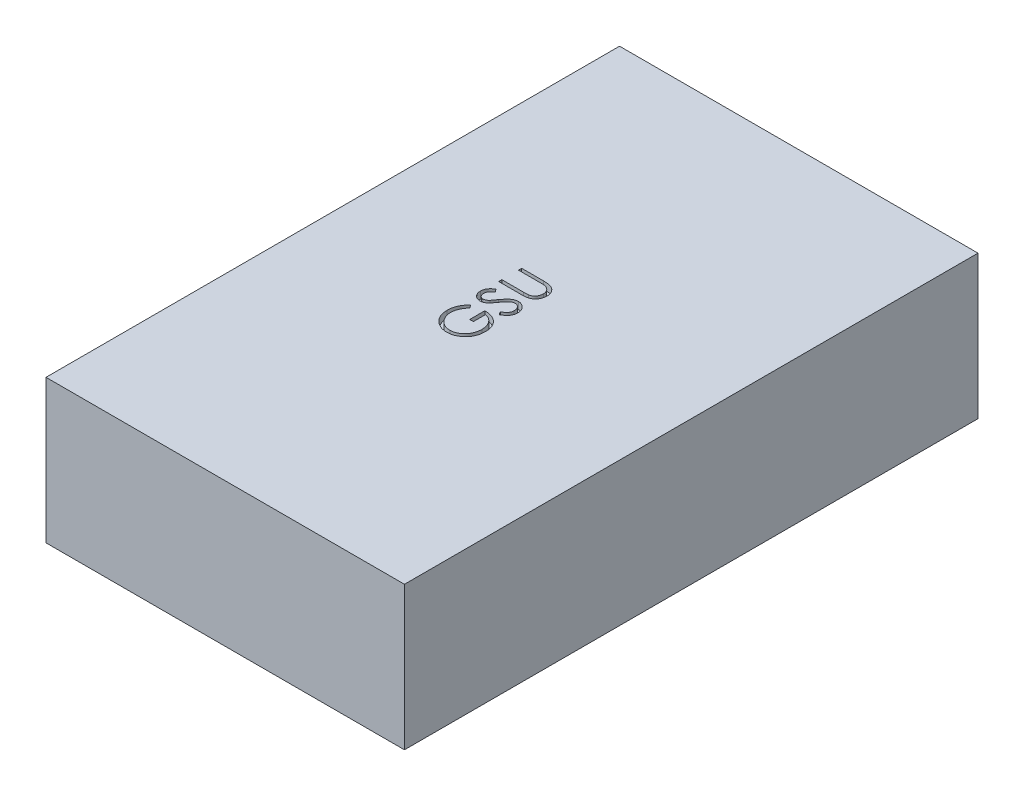
from build123d import *

# Parameters (mm, degrees)
SKETCH1_W           = 100
SKETCH1_H           = 160
BOSS_EXTRUDE1_DEPTH = 40
CUT_EXTRUDE1_DEPTH  = 2


with BuildPart() as part:
    # Sketch1 → Boss-Extrude1 (new body)
    with BuildSketch(Plane(origin=(0, 0, 0), x_dir=(1, 0, 0), z_dir=(0, 1, 0))):
        Rectangle(SKETCH1_W, SKETCH1_H)
    extrude(amount=BOSS_EXTRUDE1_DEPTH)

    # Sketch2 → Cut-Extrude1 (cut)
    with BuildSketch(Plane(origin=(0, 40, 0), x_dir=(1, 0, 0), z_dir=(0, 1, 0))):
        with BuildLine():
            Line((-8.293269231, -3.333333333), (-7.564102564, -4.102564103))
            add(Edge.make_bspline(
                [(-7.564102564, -4.102564103), (-7.69509177, -4.241732904), (-7.95394667, -4.516751946), (-8.289268783, -4.965894639), (-8.579362865, -5.432625649), (-8.813635978, -5.917699647), (-8.997412154, -6.408396791), (-9.131000621, -6.896279515), (-9.215601077, -7.378188939), (-9.225762275, -7.698658374), (-9.230769231, -7.856570513)],
                knots=[0, 0, 0, 0, 1.089067066, 2.152164705, 3.18986567, 4.218445106, 5.218487318, 6.173592265, 7.100032889, 8, 8, 8, 8], degree=3))
            add(Edge.make_bspline(
                [(-9.230769231, -7.856570513), (-9.2295875, -7.953469656), (-9.227227102, -8.147016629), (-9.197100773, -8.434507897), (-9.15377259, -8.718984003), (-9.09108151, -8.99990793), (-9.011627057, -9.277825895), (-8.91224001, -9.551771289), (-8.796367918, -9.822255206), (-8.662475005, -10.086729546), (-8.515390215, -10.343131641), (-8.352392612, -10.585291632), (-8.178716827, -10.814767236), (-7.989976038, -11.027193541), (-7.788020888, -11.223983583), (-7.576488411, -11.408757012), (-7.351219635, -11.578070093), (-7.113140916, -11.728886207), (-6.86779105, -11.865079332), (-6.617250843, -11.982771332), (-6.363846124, -12.085085488), (-6.105668795, -12.163011089), (-5.845380562, -12.229013588), (-5.581617387, -12.274959977), (-5.313690482, -12.300949452), (-5.134268489, -12.30543657), (-5.044070513, -12.307692308)],
                knots=[0, 0, 0, 0, 1.028150113, 2.053633673, 3.06513288, 4.081487945, 5.106702018, 6.131327874, 7.172780699, 8.228344599, 9.276313556, 10.308389736, 11.324843658, 12.329040066, 13.321460474, 14.316307835, 15.308626991, 16.309440696, 17.305625405, 18.28535951, 19.246194545, 20.203493668, 21.145557131, 22.095268976, 23.042464743, 24, 24, 24, 24], degree=3))
            add(Edge.make_bspline(
                [(-5.044070513, -12.307692308), (-4.951868624, -12.30553175), (-4.767716618, -12.301216534), (-4.492869755, -12.273635971), (-4.222136662, -12.222335371), (-3.955091511, -12.1543018), (-3.691202837, -12.067808441), (-3.430746028, -11.961544117), (-3.173746404, -11.834955166), (-2.922755212, -11.688751541), (-2.67846912, -11.527295918), (-2.446433466, -11.349721107), (-2.229348557, -11.155728146), (-2.024043578, -10.948874022), (-1.831814212, -10.727274033), (-1.654977492, -10.488778229), (-1.490798979, -10.236725107), (-1.341082306, -9.971002852), (-1.207346971, -9.694420053), (-1.088420656, -9.410830249), (-0.990479932, -9.119321959), (-0.910656714, -8.821428626), (-0.84522731, -8.517504975), (-0.803134505, -8.206008401), (-0.772589275, -7.889229232), (-0.770355932, -7.675690284), (-0.769230769, -7.568108974)],
                knots=[0, 0, 0, 0, 0.935915162, 1.869274651, 2.799799983, 3.730201895, 4.664668062, 5.616159355, 6.583070886, 7.570012957, 8.562524459, 9.553461134, 10.53281078, 11.515274572, 12.509912756, 13.507571325, 14.526460018, 15.561318395, 16.601025881, 17.643204557, 18.680545676, 19.719612342, 20.772381578, 21.833430283, 22.908478249, 24, 24, 24, 24], degree=3))
            add(Edge.make_bspline(
                [(-0.769230769, -7.568108974), (-0.771939863, -7.438456026), (-0.77725961, -7.183861397), (-0.818704957, -6.80962191), (-0.883352014, -6.450157287), (-0.978320732, -6.106637752), (-1.098527728, -5.777816622), (-1.247180813, -5.464906656), (-1.422715912, -5.167043817), (-1.621578466, -4.885517358), (-1.843145513, -4.627020155), (-2.080101819, -4.391757074), (-2.335517338, -4.187818154), (-2.60558548, -4.009111532), (-2.892889502, -3.861405123), (-3.195831109, -3.740131185), (-3.514597751, -3.647181309), (-3.734859238, -3.609023912), (-3.846153846, -3.58974359)],
                knots=[0, 0, 0, 0, 1.130199668, 2.219330667, 3.279027493, 4.311506524, 5.322739849, 6.327972234, 7.327472899, 8.33386792, 9.329086447, 10.29244429, 11.240784345, 12.174119183, 13.111530729, 14.052100829, 15.015757696, 16, 16, 16, 16], degree=3))
            Line((-3.846153846, -3.58974359), (-3.846153846, -6.923076923))
            Line((-3.846153846, -6.923076923), (-4.871794872, -6.923076923))
            Line((-4.871794872, -6.923076923), (-4.871794872, -2.692307692))
            add(Edge.make_bspline(
                [(-4.871794872, -2.692307692), (-4.680630618, -2.697181545), (-4.306487642, -2.706720555), (-3.760858296, -2.773631742), (-3.245510601, -2.88167892), (-2.759901825, -3.029279811), (-2.304720131, -3.220352041), (-1.879503371, -3.452844979), (-1.486998568, -3.730479611), (-1.124001415, -4.043366586), (-0.800203666, -4.394509323), (-0.515615272, -4.774419666), (-0.275893514, -5.18372529), (-0.08086305, -5.622039025), (0.071348364, -6.087925978), (0.179267155, -6.582464206), (0.243924193, -7.104983065), (0.252185277, -7.463087856), (0.256410256, -7.646233974)],
                knots=[0, 0, 0, 0, 1.140356446, 2.231883559, 3.274166699, 4.278491846, 5.25512956, 6.21435461, 7.1637429, 8.11826594, 9.068280886, 10.0076534, 10.945064095, 11.891975133, 12.864533718, 13.863980011, 14.907571808, 16, 16, 16, 16], degree=3))
            add(Edge.make_bspline(
                [(0.256410256, -7.646233974), (0.254784196, -7.759120075), (0.25157708, -7.981767849), (0.228784659, -8.310599072), (0.193697298, -8.630363703), (0.140711231, -8.941015157), (0.075812219, -9.243696134), (-0.007292692, -9.536894948), (-0.103488976, -9.821728497), (-0.212905186, -10.098637027), (-0.339681347, -10.365107161), (-0.480566032, -10.622325781), (-0.634832777, -10.871714712), (-0.805149479, -11.111575183), (-0.990242222, -11.343156959), (-1.190481991, -11.564966797), (-1.405256618, -11.778246449), (-1.557768074, -11.911847774), (-1.634615385, -11.979166667)],
                knots=[0, 0, 0, 0, 1.107784379, 2.184907829, 3.233506516, 4.263428166, 5.276301166, 6.270063455, 7.25232949, 8.225834625, 9.190232166, 10.146266622, 11.1027726, 12.066435141, 13.031522626, 14.010570082, 14.99756817, 16, 16, 16, 16], degree=3))
            add(Edge.make_bspline(
                [(-1.634615385, -11.979166667), (-1.756531536, -12.076840758), (-1.998340157, -12.270567651), (-2.385768569, -12.519933813), (-2.786916741, -12.73250925), (-3.202901394, -12.904988741), (-3.63333343, -13.039668988), (-4.077662834, -13.136258282), (-4.536461778, -13.192850536), (-4.846933963, -13.201003501), (-5.00400641, -13.205128205)],
                knots=[0, 0, 0, 0, 1.023165419, 2.029347347, 3.013907458, 3.994755782, 4.975994455, 5.96558838, 6.970761222, 8, 8, 8, 8], degree=3))
            add(Edge.make_bspline(
                [(-5.00400641, -13.205128205), (-5.121624275, -13.203607525), (-5.355365154, -13.200585492), (-5.702386029, -13.163941155), (-6.043245165, -13.111365692), (-6.377663839, -13.034088333), (-6.705865747, -12.936670659), (-7.028001971, -12.815088427), (-7.344267552, -12.673534777), (-7.652466942, -12.508992727), (-7.948580126, -12.325939192), (-8.231158039, -12.127060176), (-8.495620949, -11.910821076), (-8.742581488, -11.676592234), (-8.975699929, -11.42909529), (-9.190106786, -11.16313443), (-9.389157173, -10.882739185), (-9.569026346, -10.585735927), (-9.730648786, -10.276811267), (-9.872329012, -9.956636736), (-9.989425073, -9.625328685), (-10.088778492, -9.285364236), (-10.162250386, -8.934171439), (-10.215532498, -8.574298459), (-10.251991359, -8.203869572), (-10.254923518, -7.953480916), (-10.256410256, -7.826522436)],
                knots=[0, 0, 0, 0, 1.00895651, 2.005089799, 2.991467152, 3.967318338, 4.948153826, 5.927364234, 6.919980553, 7.91976625, 8.923240147, 9.905815003, 10.88314567, 11.851989312, 12.825009789, 13.798721852, 14.781296708, 15.773896486, 16.776076962, 17.771600213, 18.775744723, 19.78957137, 20.808953803, 21.851964491, 22.910847925, 24, 24, 24, 24], degree=3))
            add(Edge.make_bspline(
                [(-10.256410256, -7.826522436), (-10.254754566, -7.722984597), (-10.251471526, -7.517681229), (-10.228715388, -7.212179137), (-10.192647157, -6.911399095), (-10.143427766, -6.614895124), (-10.076388651, -6.323676935), (-9.99616498, -6.036914919), (-9.902759773, -5.754193387), (-9.791363069, -5.476398389), (-9.664924141, -5.201662058), (-9.522600077, -4.928456799), (-9.361957206, -4.657716097), (-9.182518533, -4.388970435), (-8.987365911, -4.120525127), (-8.770917843, -3.856626149), (-8.541709969, -3.590903451), (-8.37690373, -3.420041125), (-8.293269231, -3.333333333)],
                knots=[0, 0, 0, 0, 0.985871117, 1.954866573, 2.915460327, 3.869826059, 4.81536089, 5.759505086, 6.70452669, 7.649098992, 8.607881297, 9.583363685, 10.581137262, 11.603961102, 12.659522466, 13.73993555, 14.853081303, 16, 16, 16, 16], degree=3))
        make_face()
        with BuildLine():
            Line((-1.929086538, -1.666666667), (-2.435897436, -0.821314103))
            add(Edge.make_bspline(
                [(-2.435897436, -0.821314103), (-2.304284907, -0.742690568), (-2.052120382, -0.592050909), (-1.711383124, -0.340761311), (-1.421776961, -0.080381565), (-1.184986654, 0.191016531), (-0.998561264, 0.471776383), (-0.866554887, 0.763730822), (-0.784223529, 1.065895995), (-0.774223282, 1.271535485), (-0.769230769, 1.374198718)],
                knots=[0, 0, 0, 0, 1.272034388, 2.437168799, 3.508375237, 4.49857839, 5.41946034, 6.295179144, 7.148887113, 8, 8, 8, 8], degree=3))
            add(Edge.make_bspline(
                [(-0.769230769, 1.374198718), (-0.771730785, 1.461857712), (-0.776687073, 1.635641874), (-0.822386505, 1.891981586), (-0.897150681, 2.139693044), (-0.998501617, 2.376313841), (-1.123083951, 2.595575075), (-1.269989904, 2.790929086), (-1.439734474, 2.955884837), (-1.626029427, 3.09263515), (-1.825800095, 3.198451547), (-2.031635392, 3.278428609), (-2.246359533, 3.323220072), (-2.390966647, 3.32994142), (-2.463942308, 3.333333333)],
                knots=[0, 0, 0, 0, 1.09553864, 2.171907928, 3.244545276, 4.325730702, 5.384330216, 6.391480148, 7.371786628, 8.333890167, 9.27165687, 10.191402356, 11.087295184, 12, 12, 12, 12], degree=3))
            add(Edge.make_bspline(
                [(-2.463942308, 3.333333333), (-2.547229668, 3.329211489), (-2.715895654, 3.320864303), (-2.965168274, 3.247300006), (-3.212917594, 3.134970402), (-3.366195373, 3.029393198), (-3.445512821, 2.974759615)],
                knots=[0, 0, 0, 0, 0.938992559, 1.901562324, 2.914110574, 4, 4, 4, 4], degree=3))
            add(Edge.make_bspline(
                [(-3.445512821, 2.974759615), (-3.502796701, 2.929992996), (-3.623057042, 2.836011077), (-3.801916277, 2.674302935), (-3.986783264, 2.485515488), (-4.181716481, 2.272232592), (-4.38509684, 2.034096483), (-4.598511417, 1.771015025), (-4.817599065, 1.480742967), (-4.964345407, 1.27700199), (-5.040064103, 1.171875)],
                knots=[0, 0, 0, 0, 0.72225051, 1.516274602, 2.393638633, 3.3469932, 4.386926276, 5.505032946, 6.712638081, 8, 8, 8, 8], degree=3))
            add(Edge.make_bspline(
                [(-5.040064103, 1.171875), (-5.115002924, 1.066663582), (-5.258280245, 0.865507364), (-5.470921057, 0.584197128), (-5.665332112, 0.33264152), (-5.843343575, 0.111958615), (-6.004979589, -0.077754519), (-6.148687987, -0.237992836), (-6.278355303, -0.364674427), (-6.362473423, -0.435118944), (-6.400240385, -0.466746795)],
                knots=[0, 0, 0, 0, 1.452282411, 2.77665338, 3.964542531, 5.026858415, 5.96415736, 6.766646006, 7.446254459, 8, 8, 8, 8], degree=3))
            add(Edge.make_bspline(
                [(-6.400240385, -0.466746795), (-6.459103412, -0.510946657), (-6.574865455, -0.597871619), (-6.755751983, -0.712737221), (-6.940566514, -0.809603695), (-7.129978857, -0.887563097), (-7.322565464, -0.950605912), (-7.519772201, -0.994436841), (-7.72026031, -1.021453299), (-7.855151357, -1.024244021), (-7.922676282, -1.025641026)],
                knots=[0, 0, 0, 0, 1.068019517, 2.100403715, 3.106014851, 4.09224787, 5.069873182, 6.043214339, 7.020455327, 8, 8, 8, 8], degree=3))
            add(Edge.make_bspline(
                [(-7.922676282, -1.025641026), (-8.028475845, -1.021912023), (-8.237813579, -1.014533723), (-8.543612951, -0.952129836), (-8.835585327, -0.853644831), (-9.110772842, -0.715625721), (-9.362261339, -0.53787367), (-9.592314454, -0.331275882), (-9.788353177, -0.087484865), (-9.956967076, 0.182409914), (-10.090307723, 0.476278768), (-10.186940155, 0.78565877), (-10.244338606, 1.108325995), (-10.252346836, 1.327228779), (-10.256410256, 1.438301282)],
                knots=[0, 0, 0, 0, 1.005248779, 1.989011071, 2.95484373, 3.928844559, 4.904706341, 5.875556129, 6.859318422, 7.868909462, 8.894684146, 9.918924798, 10.944050749, 12, 12, 12, 12], degree=3))
            add(Edge.make_bspline(
                [(-10.256410256, 1.438301282), (-10.252401012, 1.556160649), (-10.244427905, 1.790545313), (-10.173378529, 2.134761655), (-10.060300233, 2.467526263), (-9.927629766, 2.734026951), (-9.795967098, 2.943045237), (-9.6757825, 3.10228837), (-9.537707384, 3.264534612), (-9.378830913, 3.428040301), (-9.202330776, 3.594419578), (-9.006712887, 3.76290606), (-8.793740081, 3.935076493), (-8.641663576, 4.045801299), (-8.563701923, 4.102564103)],
                knots=[0, 0, 0, 0, 1.286507425, 2.558452658, 3.822738219, 5.118007103, 5.800084425, 6.519418873, 7.295692132, 8.12638276, 9.008892966, 9.945018126, 10.946518512, 12, 12, 12, 12], degree=3))
            Line((-8.563701923, 4.102564103), (-7.948717949, 3.291266026))
            add(Edge.make_bspline(
                [(-7.948717949, 3.291266026), (-8.011832145, 3.242281219), (-8.133375331, 3.147947934), (-8.303530505, 3.004673319), (-8.459170798, 2.869838174), (-8.594000969, 2.735976365), (-8.718117633, 2.613405923), (-8.822495726, 2.492331135), (-8.910433101, 2.377424292), (-9.004449858, 2.232932112), (-9.094826484, 2.049893619), (-9.174211726, 1.822040153), (-9.221307288, 1.583119217), (-9.227589112, 1.420477152), (-9.230769231, 1.338141026)],
                knots=[0, 0, 0, 0, 1.181392137, 2.275085037, 3.289537922, 4.225335853, 5.084247276, 5.86831218, 6.587234301, 7.222706459, 8.415108401, 9.595592188, 10.782789524, 12, 12, 12, 12], degree=3))
            add(Edge.make_bspline(
                [(-9.230769231, 1.338141026), (-9.227363919, 1.234812297), (-9.220797097, 1.035552579), (-9.147190315, 0.753321176), (-9.035276162, 0.497831327), (-8.873897121, 0.278836311), (-8.68150222, 0.098015524), (-8.462089385, -0.034406466), (-8.219756446, -0.113579246), (-8.050793634, -0.123269856), (-7.96474359, -0.128205128)],
                knots=[0, 0, 0, 0, 1.144248881, 2.206576175, 3.214949548, 4.222996039, 5.203671638, 6.127710127, 7.046472867, 8, 8, 8, 8], degree=3))
            add(Edge.make_bspline(
                [(-7.96474359, -0.128205128), (-7.911180222, -0.127017743), (-7.803307328, -0.124626431), (-7.644692731, -0.09406934), (-7.486914458, -0.05275364), (-7.330527806, 0.010585307), (-7.171991504, 0.098790037), (-7.009066356, 0.21449575), (-6.840349016, 0.360255312), (-6.730613388, 0.471902832), (-6.672676282, 0.530849359)],
                knots=[0, 0, 0, 0, 0.858259122, 1.72847414, 2.583651051, 3.473048463, 4.427392529, 5.488649985, 6.674082839, 8, 8, 8, 8], degree=3))
            add(Edge.make_bspline(
                [(-6.672676282, 0.530849359), (-6.653141923, 0.552738994), (-6.606732756, 0.604743758), (-6.530754811, 0.699817831), (-6.437032605, 0.825368683), (-6.321068843, 0.97811783), (-6.18655038, 1.16088172), (-6.035197203, 1.373680452), (-5.862095891, 1.614141974), (-5.741074346, 1.78477602), (-5.677083333, 1.875)],
                knots=[0, 0, 0, 0, 0.420754252, 0.999615792, 1.744751191, 2.668019286, 3.750313428, 4.999500688, 6.413464383, 8, 8, 8, 8], degree=3))
            add(Edge.make_bspline(
                [(-5.677083333, 1.875), (-5.598107964, 1.983531104), (-5.445183108, 2.193686545), (-5.215424777, 2.492709238), (-4.990714283, 2.763830857), (-4.772501229, 3.008023352), (-4.562392054, 3.227631986), (-4.35802185, 3.420442977), (-4.160730851, 3.587331153), (-3.909511553, 3.769451873), (-3.598116037, 3.953339813), (-3.216425823, 4.111008608), (-2.833640278, 4.211314796), (-2.576694841, 4.224341803), (-2.449919872, 4.230769231)],
                knots=[0, 0, 0, 0, 1.163604038, 2.253157948, 3.268574773, 4.215621239, 5.091738613, 5.902582348, 6.650434646, 7.330118262, 8.591011492, 9.77460283, 10.902005569, 12, 12, 12, 12], degree=3))
            add(Edge.make_bspline(
                [(-2.449919872, 4.230769231), (-2.36026835, 4.22888978), (-2.182706278, 4.225167375), (-1.921963676, 4.182449734), (-1.668783982, 4.119718627), (-1.426547093, 4.025930407), (-1.191366253, 3.909591752), (-0.967671813, 3.764085591), (-0.751117872, 3.594543374), (-0.54777556, 3.400158023), (-0.360877776, 3.187564678), (-0.195310615, 2.96205939), (-0.054080499, 2.725996232), (0.058395439, 2.476818799), (0.146956824, 2.217203916), (0.210944304, 1.946295471), (0.250259707, 1.663819038), (0.254337186, 1.471816577), (0.256410256, 1.374198718)],
                knots=[0, 0, 0, 0, 0.983922938, 1.948738757, 2.895227473, 3.844781104, 4.796118043, 5.772795661, 6.770647148, 7.813532943, 8.8582745, 9.876489951, 10.882905461, 11.874265028, 12.874055871, 13.891769171, 14.928133632, 16, 16, 16, 16], degree=3))
            add(Edge.make_bspline(
                [(0.256410256, 1.374198718), (0.254949737, 1.298669167), (0.252047093, 1.148561281), (0.226386294, 0.926534187), (0.190080275, 0.708992515), (0.13244011, 0.498665954), (0.06250576, 0.29284493), (-0.023603274, 0.092423688), (-0.126797127, -0.102691442), (-0.244775812, -0.293607144), (-0.382111277, -0.47978669), (-0.541925426, -0.659685692), (-0.720143043, -0.838036792), (-0.919517287, -1.013574826), (-1.142240584, -1.18247011), (-1.384995379, -1.348777276), (-1.648503572, -1.511685835), (-1.833811983, -1.614041484), (-1.929086538, -1.666666667)],
                knots=[0, 0, 0, 0, 0.915313873, 1.819100311, 2.706792138, 3.586475221, 4.459428225, 5.3405999, 6.2277379, 7.133009489, 8.059106158, 9.028520402, 10.047404263, 11.114294124, 12.246039232, 13.433834781, 14.680630578, 16, 16, 16, 16], degree=3))
        make_face()
        with BuildLine():
            Line((-10, 6.282051282), (-10, 7.179487179))
            Line((-10, 7.179487179), (-4.008413462, 7.179487179))
            add(Edge.make_bspline(
                [(-4.008413462, 7.179487179), (-3.923611359, 7.179353625), (-3.762684757, 7.179100183), (-3.533632469, 7.18079308), (-3.329996872, 7.185534133), (-3.150993022, 7.18852316), (-2.997442315, 7.195172684), (-2.868512856, 7.200595675), (-2.764815135, 7.207568695), (-2.704298203, 7.21594903), (-2.678285256, 7.219551282)],
                knots=[0, 0, 0, 0, 1.528628734, 2.90083645, 4.128790002, 5.200304208, 6.127813768, 6.898992206, 7.526736466, 8, 8, 8, 8], degree=3))
            add(Edge.make_bspline(
                [(-2.678285256, 7.219551282), (-2.583717809, 7.23417552), (-2.401159603, 7.262406953), (-2.141380547, 7.337412602), (-1.90682364, 7.437407215), (-1.692198108, 7.561456514), (-1.498867921, 7.718193339), (-1.325349243, 7.912786947), (-1.167664869, 8.141748537), (-1.030186766, 8.401797761), (-0.915999617, 8.678880665), (-0.830558322, 8.96306383), (-0.778268305, 9.248862527), (-0.772229515, 9.440228029), (-0.769230769, 9.53525641)],
                knots=[0, 0, 0, 0, 1.042777144, 2.01303441, 2.939567723, 3.817555404, 4.708046775, 5.641195415, 6.651191522, 7.732783915, 8.843021186, 9.914367358, 10.964315445, 12, 12, 12, 12], degree=3))
            add(Edge.make_bspline(
                [(-0.769230769, 9.53525641), (-0.772281905, 9.616845698), (-0.778366555, 9.779553036), (-0.816509659, 10.021178873), (-0.883897554, 10.257252264), (-0.975692169, 10.485918644), (-1.088574938, 10.7034618), (-1.223806661, 10.904304198), (-1.381325426, 11.084291598), (-1.555899695, 11.248540131), (-1.752624709, 11.39072635), (-1.966754454, 11.516441201), (-2.203998604, 11.616281904), (-2.370627686, 11.66683095), (-2.455929487, 11.692708333)],
                knots=[0, 0, 0, 0, 0.994718802, 1.98369237, 2.973235266, 3.981451368, 4.982709966, 5.955777334, 6.925228988, 7.892833478, 8.871333226, 9.877970804, 10.913677552, 12, 12, 12, 12], degree=3))
            add(Edge.make_bspline(
                [(-2.455929487, 11.692708333), (-2.491211128, 11.70128012), (-2.569832843, 11.720381515), (-2.702750816, 11.738230215), (-2.85957757, 11.756820287), (-3.041439892, 11.769719059), (-3.247728385, 11.782293974), (-3.479517692, 11.789817039), (-3.735966152, 11.793294276), (-3.914929471, 11.794330506), (-4.008413462, 11.794871795)],
                knots=[0, 0, 0, 0, 0.558680831, 1.244966039, 2.062412453, 2.990489873, 4.051219941, 5.244515665, 6.560634259, 8, 8, 8, 8], degree=3))
            Line((-4.008413462, 11.794871795), (-10, 11.794871795))
            Line((-10, 11.794871795), (-10, 12.692307692))
            Line((-10, 12.692307692), (-3.960336538, 12.692307692))
            add(Edge.make_bspline(
                [(-3.960336538, 12.692307692), (-3.851484049, 12.691581531), (-3.639051797, 12.690164382), (-3.3277619, 12.677878457), (-3.032468726, 12.658281956), (-2.753126531, 12.630619123), (-2.490755686, 12.593882208), (-2.243628014, 12.553406504), (-2.013106021, 12.500959983), (-1.796530076, 12.440153923), (-1.589328241, 12.371633799), (-1.3930686, 12.281328628), (-1.201986988, 12.180026631), (-1.018223011, 12.060850168), (-0.842944201, 11.923742835), (-0.67161326, 11.773957373), (-0.509336311, 11.606214277), (-0.35411193, 11.425468153), (-0.209753215, 11.23293425), (-0.084128407, 11.027369381), (0.018164249, 10.809908449), (0.108950998, 10.585700769), (0.173479907, 10.349370832), (0.222544184, 10.103862461), (0.250188368, 9.847719425), (0.254318711, 9.673538964), (0.256410256, 9.585336538)],
                knots=[0, 0, 0, 0, 1.316707045, 2.569633854, 3.76780728, 4.896239288, 5.964314126, 6.972204208, 7.924543903, 8.822147865, 9.693191779, 10.560896119, 11.431827672, 12.307838457, 13.206132673, 14.12176355, 15.058527151, 16.026630406, 17.00238624, 17.966538933, 18.934743273, 19.906713913, 20.888635248, 21.892958714, 22.933025263, 24, 24, 24, 24], degree=3))
            add(Edge.make_bspline(
                [(0.256410256, 9.585336538), (0.254169624, 9.4891384), (0.249773511, 9.300397996), (0.224543645, 9.022299184), (0.177142717, 8.75565093), (0.116396114, 8.497850816), (0.033983246, 8.25138948), (-0.067280187, 8.016339552), (-0.182887782, 7.790002168), (-0.319496382, 7.577476656), (-0.468458866, 7.377019601), (-0.63207782, 7.194849972), (-0.804121798, 7.026343377), (-0.99106912, 6.87892721), (-1.189092804, 6.747025703), (-1.399124247, 6.633545371), (-1.620881891, 6.536069733), (-1.775035111, 6.485766509), (-1.852964744, 6.460336538)],
                knots=[0, 0, 0, 0, 1.138939089, 2.234594419, 3.301501784, 4.342532435, 5.367382236, 6.373123747, 7.370098489, 8.372230273, 9.360297234, 10.323289009, 11.268038109, 12.20748145, 13.137029304, 14.081414587, 15.030090602, 16, 16, 16, 16], degree=3))
            add(Edge.make_bspline(
                [(-1.852964744, 6.460336538), (-1.906200671, 6.445544658), (-2.021670582, 6.41346074), (-2.212774835, 6.379102746), (-2.432817457, 6.350219656), (-2.681813509, 6.323060918), (-2.959955985, 6.307035324), (-3.267124316, 6.292985499), (-3.603689921, 6.281952303), (-3.838131394, 6.282017367), (-3.960336538, 6.282051282)],
                knots=[0, 0, 0, 0, 0.625038921, 1.35572334, 2.194682327, 3.136881307, 4.189498639, 5.346923369, 6.617055217, 8, 8, 8, 8], degree=3))
            Line((-3.960336538, 6.282051282), (-10, 6.282051282))
        make_face()
    extrude(amount=-CUT_EXTRUDE1_DEPTH, mode=Mode.SUBTRACT)


solid = part.part
